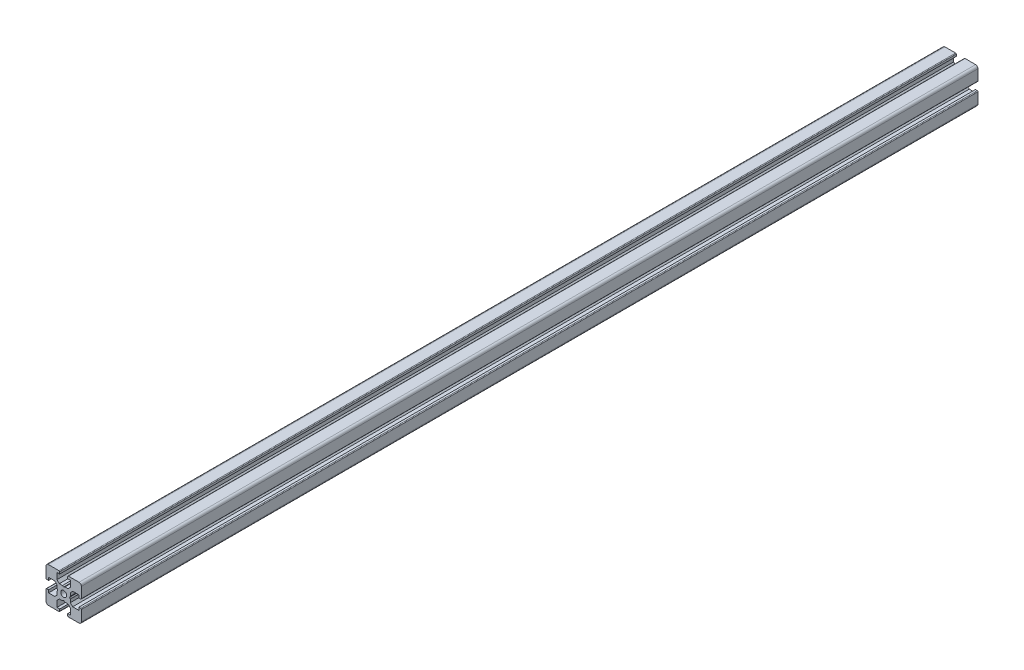
from build123d import *

# Parameters (mm, degrees)
SKETCH1_R           = 1.25
BOSS_EXTRUDE1_DEPTH = 380


with BuildPart() as part:
    # Sketch1 → Boss-Extrude1 (new body)
    with BuildSketch(Plane.XY):
        with BuildLine():
            Line((-7.2, 1.7), (-6.4, 1.7))
            Line((-6.4, 1.7), (-6.4, 2.85))
            Line((-6.4, 2.85), (-3.8, 2.85))
            Line((-3.8, 2.85), (-2.8, 1.85))
            Line((-2.8, 1.85), (-2.8, 0.519615242))
            Line((-2.8, 0.519615242), (-2.5, 0))
            Line((-2.5, 0), (-2.8, -0.519615242))
            Line((-2.8, -0.519615242), (-2.8, -1.85))
            Line((-2.8, -1.85), (-3.8, -2.85))
            Line((-3.8, -2.85), (-6.4, -2.85))
            Line((-6.4, -2.85), (-6.4, -1.7))
            Line((-6.4, -1.7), (-7.2, -1.7))
            ThreePointArc((-7.2, -1.7), (-7.412132034, -1.787867966), (-7.5, -2))
            Line((-7.5, -2), (-7.5, -6.5))
            ThreePointArc((-7.5, -6.5), (-7.207106781, -7.207106781), (-6.5, -7.5))
            Line((-6.5, -7.5), (-2, -7.5))
            ThreePointArc((-2, -7.5), (-1.787867966, -7.412132034), (-1.7, -7.2))
            Line((-1.7, -7.2), (-1.7, -6.4))
            Line((-1.7, -6.4), (-2.85, -6.4))
            Line((-2.85, -6.4), (-2.85, -3.8))
            Line((-2.85, -3.8), (-1.85, -2.8))
            Line((-1.85, -2.8), (-0.519615242, -2.8))
            Line((-0.519615242, -2.8), (0, -2.5))
            Line((0, -2.5), (0.519615242, -2.8))
            Line((0.519615242, -2.8), (1.85, -2.8))
            Line((1.85, -2.8), (2.85, -3.8))
            Line((2.85, -3.8), (2.85, -6.4))
            Line((2.85, -6.4), (1.7, -6.4))
            Line((1.7, -6.4), (1.7, -7.2))
            ThreePointArc((1.7, -7.2), (1.787867966, -7.412132034), (2, -7.5))
            Line((2, -7.5), (6.5, -7.5))
            ThreePointArc((6.5, -7.5), (7.207106781, -7.207106781), (7.5, -6.5))
            Line((7.5, -6.5), (7.5, -2))
            ThreePointArc((7.5, -2), (7.412132034, -1.787867966), (7.2, -1.7))
            Line((7.2, -1.7), (6.4, -1.7))
            Line((6.4, -1.7), (6.4, -2.85))
            Line((6.4, -2.85), (3.8, -2.85))
            Line((3.8, -2.85), (2.8, -1.85))
            Line((2.8, -1.85), (2.8, -0.519615242))
            Line((2.8, -0.519615242), (2.5, 0))
            Line((2.5, 0), (2.8, 0.519615242))
            Line((2.8, 0.519615242), (2.8, 1.85))
            Line((2.8, 1.85), (3.8, 2.85))
            Line((3.8, 2.85), (6.4, 2.85))
            Line((6.4, 2.85), (6.4, 1.7))
            Line((6.4, 1.7), (7.2, 1.7))
            ThreePointArc((7.2, 1.7), (7.412132034, 1.787867966), (7.5, 2))
            Line((7.5, 2), (7.5, 6.5))
            ThreePointArc((7.5, 6.5), (7.207106781, 7.207106781), (6.5, 7.5))
            Line((6.5, 7.5), (2, 7.5))
            ThreePointArc((2, 7.5), (1.787867966, 7.412132034), (1.7, 7.2))
            Line((1.7, 7.2), (1.7, 6.4))
            Line((1.7, 6.4), (2.85, 6.4))
            Line((2.85, 6.4), (2.85, 3.8))
            Line((2.85, 3.8), (1.85, 2.8))
            Line((1.85, 2.8), (0.519615242, 2.8))
            Line((0.519615242, 2.8), (0, 2.5))
            Line((0, 2.5), (-0.519615242, 2.8))
            Line((-0.519615242, 2.8), (-1.85, 2.8))
            Line((-1.85, 2.8), (-2.85, 3.8))
            Line((-2.85, 3.8), (-2.85, 6.4))
            Line((-2.85, 6.4), (-1.7, 6.4))
            Line((-1.7, 6.4), (-1.7, 7.2))
            ThreePointArc((-1.7, 7.2), (-1.787867966, 7.412132034), (-2, 7.5))
            Line((-2, 7.5), (-6.5, 7.5))
            ThreePointArc((-6.5, 7.5), (-7.207106781, 7.207106781), (-7.5, 6.5))
            Line((-7.5, 6.5), (-7.5, 2))
            ThreePointArc((-7.5, 2), (-7.412132034, 1.787867966), (-7.2, 1.7))
        make_face()
        Circle(SKETCH1_R, mode=Mode.SUBTRACT)
    extrude(amount=BOSS_EXTRUDE1_DEPTH)


solid = part.part
